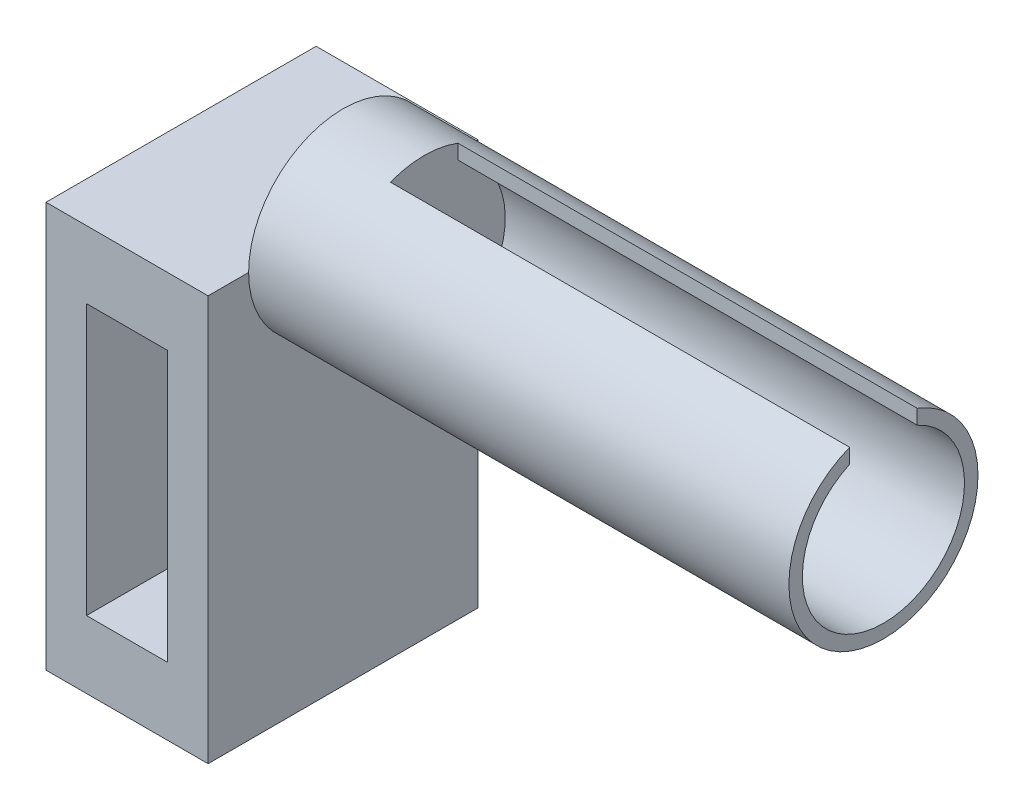
from build123d import *

# Parameters (mm, degrees)
SKETCH1_W           = 6
SKETCH1_H           = 15
BOSS_EXTRUDE1_DEPTH = 10
SKETCH2_W           = 3
SKETCH2_H           = 10
CUT_EXTRUDE1_DEPTH  = 7
SKETCH3_R           = 3.5
BOSS_EXTRUDE2_DEPTH = 20
SKETCH5_R           = 3
CUT_EXTRUDE2_DEPTH  = 17
SKETCH6_W           = 2.5
SKETCH6_H           = 1
CUT_EXTRUDE3_DEPTH  = 17


with BuildPart() as part:
    # Sketch1 → Boss-Extrude1 (new body)
    with BuildSketch(Plane.XY):
        Rectangle(SKETCH1_W, SKETCH1_H)
    extrude(amount=BOSS_EXTRUDE1_DEPTH)

    # Sketch2 → Cut-Extrude1 (cut)
    with BuildSketch(Plane.XY.offset(10)):
        Rectangle(SKETCH2_W, SKETCH2_H)
    extrude(amount=-CUT_EXTRUDE1_DEPTH, mode=Mode.SUBTRACT)

    # Sketch3 → Boss-Extrude2 (add)
    with BuildSketch(Plane(origin=(3, 0, 0), x_dir=(0, 0, -1), z_dir=(1, 0, 0))):
        with Locations((-5, 7.5)):
            Circle(SKETCH3_R)
    extrude(amount=BOSS_EXTRUDE2_DEPTH)

    # Sketch5 → Cut-Extrude2 (cut)
    with BuildSketch(Plane(origin=(23, 0, 0), x_dir=(0, 0, -1), z_dir=(1, 0, 0))):
        with Locations(Location((-5, 7.5, 0), (0, 0, 90))):
            Circle(SKETCH5_R)
    extrude(amount=-CUT_EXTRUDE2_DEPTH, mode=Mode.SUBTRACT)

    # Sketch6 → Cut-Extrude3 (cut)
    with BuildSketch(Plane(origin=(23, 0, 0), x_dir=(0, 0, -1), z_dir=(1, 0, 0))):
        with Locations((-5, 10.5)):
            Rectangle(SKETCH6_W, SKETCH6_H)
    extrude(amount=-CUT_EXTRUDE3_DEPTH, mode=Mode.SUBTRACT)


solid = part.part
